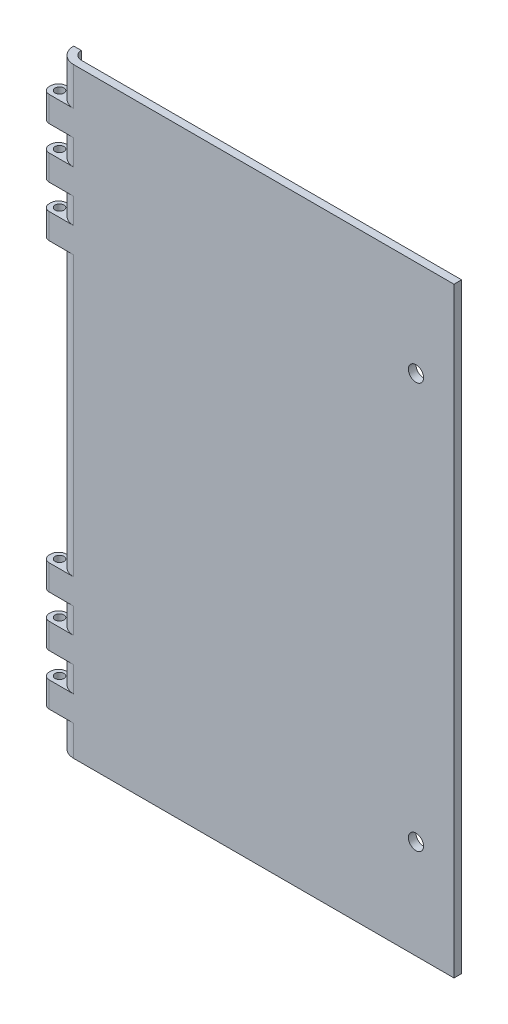
from build123d import *

# Parameters (mm, degrees)
BOSS_EXTRUDE1_DEPTH     = 609.6
SHELL1_T                = -7.62
SKETCH3_W               = 28.861952205
SKETCH3_H               = 274.814581436
CUT_EXTRUDE2_DEPTH      = 609.6
SKETCH4_W               = 397.1798
SKETCH4_H               = 244.7798
CUT_EXTRUDE3_DEPTH      = 609.6
SKETCH5_W               = 397.1798
SKETCH5_H               = 7.62
CUT_EXTRUDE4_DEPTH      = 609.6
BOSS_EXTRUDE4_START     = 25.4
BOSS_EXTRUDE4_DEPTH     = 25.4
LPATTERN2_COUNT         = 3
LPATTERN2_PITCH         = 50.8
LPATTERN3_COUNT         = 2
LPATTERN3_PITCH         = 508
LPATTERN6_COUNT         = 2
LPATTERN6_PITCH         = 457.2
LPATTERN7_COUNT         = 2
LPATTERN7_PITCH         = 406.4
CUT_EXTRUDE5_DEPTH      = 660.835961681
CUT_EXTRUDE5_DEPTH_BACK = 660.835961681
SKETCH11_R              = 4.445
CUT_EXTRUDE6_DEPTH      = 660.835961681
CUT_EXTRUDE6_DEPTH_BACK = 660.835961681
CUT_EXTRUDE7_DEPTH      = 681.722733812
CUT_EXTRUDE7_DEPTH_BACK = 681.722733812
CUT_EXTRUDE8_DEPTH      = 713.602768959
CUT_EXTRUDE8_DEPTH_BACK = 713.602768959
SKETCH16_R              = 7.62


with BuildPart() as part:
    # Sketch1 → Boss-Extrude1 (new body)
    with BuildSketch(Plane(origin=(0, 0, 0), x_dir=(1, 0, 0), z_dir=(0, 1, 0))):
        with BuildLine():
            Line((0, 0), (381, 0))
            ThreePointArc((381, 0), (392.440846298, 4.738953702), (397.1798, 16.1798))
            Line((397.1798, 16.1798), (397.1798, 244.7798))
            ThreePointArc((397.1798, 244.7798), (392.440846298, 256.220646298), (381, 260.9596))
            Line((381, 260.9596), (0, 260.9596))
            ThreePointArc((0, 260.9596), (-11.440846298, 256.220646298), (-16.1798, 244.7798))
            Line((-16.1798, 244.7798), (-16.1798, 16.1798))
            ThreePointArc((-16.1798, 16.1798), (-11.440846298, 4.738953702), (0, 0))
        make_face()
    extrude(amount=-BOSS_EXTRUDE1_DEPTH)

    # Shell1
    shell1_openings = [part.faces().sort_by_distance(p)[0] for p in [
        (190.5, 0, -130.4798),
    ]]
    offset(amount=SHELL1_T, openings=shell1_openings, kind=Kind.INTERSECTION)

    # Sketch3 → Cut-Extrude2 (cut)
    with BuildSketch(Plane(origin=(0, 0, 0), x_dir=(1, 0, 0), z_dir=(0, 1, 0))):
        with Locations((395.430976103, 137.407290718)):
            Rectangle(SKETCH3_W, SKETCH3_H)
    extrude(amount=-CUT_EXTRUDE2_DEPTH, mode=Mode.SUBTRACT)

    # Sketch4 → Cut-Extrude3 (cut)
    with BuildSketch(Plane(origin=(0, 0, 0), x_dir=(1, 0, 0), z_dir=(0, 1, 0))):
        with Locations((182.4101, 138.5697)):
            Rectangle(SKETCH4_W, SKETCH4_H)
    extrude(amount=-CUT_EXTRUDE3_DEPTH, mode=Mode.SUBTRACT)

    # Sketch5 → Cut-Extrude4 (cut)
    with BuildSketch(Plane(origin=(0, 0, -16.1798), x_dir=(-1, 0, 0), z_dir=(0, 0, -1))):
        with Locations((-182.4101, -605.79)):
            Rectangle(SKETCH5_W, SKETCH5_H)
    extrude(amount=-CUT_EXTRUDE4_DEPTH, mode=Mode.SUBTRACT)

    # Sketch8 → Boss-Extrude4 (add)
    with BuildSketch(Plane(origin=(0, -63.5, 0), x_dir=(1, 0, 0), z_dir=(0, 1, 0)).offset(BOSS_EXTRUDE4_START)):
        with BuildLine():
            Line((-16.1798, 16.1798), (-31.4198, 16.1798))
            Line((-31.4198, 16.1798), (-31.4198, 3.2512))
            ThreePointArc((-31.4198, 3.2512), (-30.467545567, 0.952254433), (-28.1686, 0))
            Line((-28.1686, 0), (0, 0))
            ThreePointArc((0, 0), (-11.440846298, 4.738953702), (-16.1798, 16.1798))
        make_face()
    boss_extrude4 = extrude(amount=-BOSS_EXTRUDE4_DEPTH)

    # LPattern2: Boss-Extrude4 ×3
    with Locations(*[(0, -i * LPATTERN2_PITCH, 0) for i in range(1, LPATTERN2_COUNT)]):
        add(boss_extrude4)

    # LPattern3: Boss-Extrude4 ×2
    with Locations(*[(0, -i * LPATTERN3_PITCH, 0) for i in range(1, LPATTERN3_COUNT)]):
        add(boss_extrude4)

    # LPattern6: Boss-Extrude4 ×2
    with Locations(*[(0, -i * LPATTERN6_PITCH, 0) for i in range(1, LPATTERN6_COUNT)]):
        add(boss_extrude4)

    # LPattern7: Boss-Extrude4 ×2
    with Locations(*[(0, -i * LPATTERN7_PITCH, 0) for i in range(1, LPATTERN7_COUNT)]):
        add(boss_extrude4)

    # Sketch11 → Cut-Extrude5 (cut, two sides: drawn at the far end of the back side and taken through both)
    with BuildSketch(Plane(origin=(0, -63.5, 0), x_dir=(1, 0, 0), z_dir=(0, 1, 0)).offset(-CUT_EXTRUDE5_DEPTH_BACK)):
        with Locations(Location((-22.7838, 8.5598, 0), (0, 0, 270))):
            Circle(SKETCH11_R)
    extrude(amount=CUT_EXTRUDE5_DEPTH + CUT_EXTRUDE5_DEPTH_BACK, mode=Mode.SUBTRACT)

    # Sketch14 → Cut-Extrude6 (cut, two sides: drawn at the far end of the back side and taken through both)
    with BuildSketch(Plane(origin=(0, -63.5, 0), x_dir=(1, 0, 0), z_dir=(0, 1, 0)).offset(-CUT_EXTRUDE6_DEPTH_BACK)):
        with BuildLine():
            Line((-23.2901518, 16.1798), (-23.2901518, 22.367061587))
            Line((-23.2901518, 22.367061587), (-43.448334217, 22.367061587))
            Line((-43.448334217, 22.367061587), (-43.448334217, 8.0501518))
            Line((-43.448334217, 8.0501518), (-31.4198, 8.0501518))
            ThreePointArc((-31.4198, 8.0501518), (-29.038681171, 13.798681171), (-23.2901518, 16.1798))
        make_face()
    extrude(amount=CUT_EXTRUDE6_DEPTH + CUT_EXTRUDE6_DEPTH_BACK, mode=Mode.SUBTRACT)

    # Sketch15 → Cut-Extrude7 (cut, two sides: drawn at the far end of the back side and taken through both)
    with BuildSketch(Plane(origin=(0, -38.1, 0), x_dir=(1, 0, 0), z_dir=(0, 1, 0)).offset(-CUT_EXTRUDE7_DEPTH_BACK)):
        with BuildLine():
            Line((-31.4198, 6.877959665), (-31.4198, 0))
            Line((-31.4198, 0), (-24.541840335, 0))
            ThreePointArc((-24.541840335, 0), (-29.405292255, 2.014507745), (-31.4198, 6.877959665))
        make_face()
    extrude(amount=CUT_EXTRUDE7_DEPTH + CUT_EXTRUDE7_DEPTH_BACK, mode=Mode.SUBTRACT)

    # Sketch16 → Cut-Extrude8 (cut, two sides: drawn at the far end of the back side and taken through both)
    with BuildSketch(Plane.XY.offset(-CUT_EXTRUDE8_DEPTH_BACK)):
        with Locations((342.9, -96.52)):
            Circle(SKETCH16_R)
        with Locations((342.9, -502.92)):
            Circle(SKETCH16_R)
    extrude(amount=CUT_EXTRUDE8_DEPTH + CUT_EXTRUDE8_DEPTH_BACK, mode=Mode.SUBTRACT)


solid = part.part
